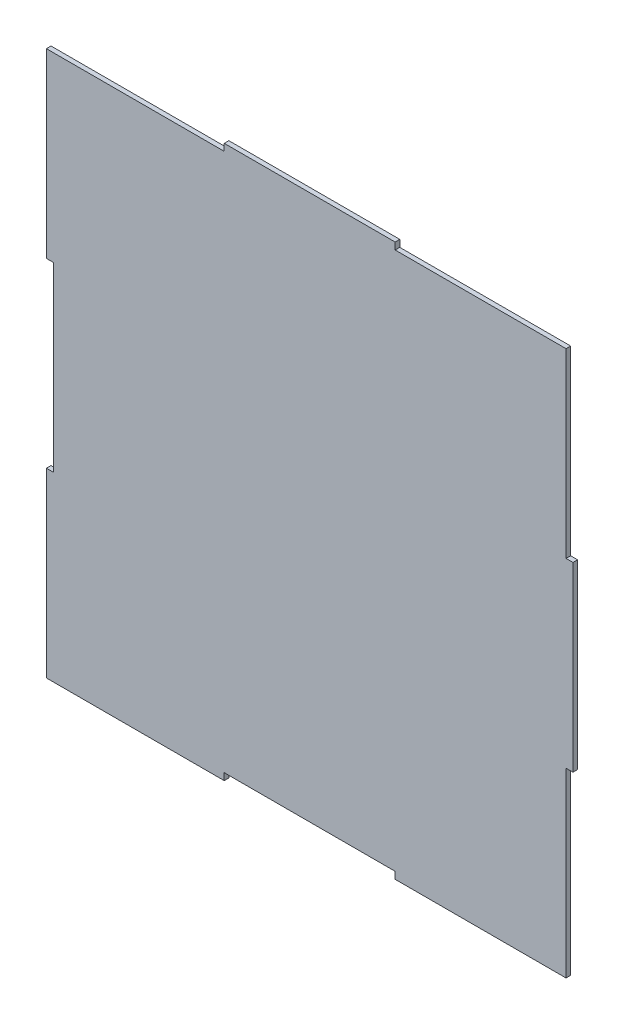
from build123d import *

# Parameters (mm, degrees)
BOSS_EXTRUDE1_DEPTH = 2


with BuildPart() as part:
    # Sketch1 → Boss-Extrude1 (new body)
    with BuildSketch(Plane.XY):
        Polygon((37, -118), (111, -118), (111, -39.333333333), (114, -39.333333333), (114, 39.333333333), (111, 39.333333333), (111, 118), (37, 118), (37, 121), (-37, 121), (-37, 118), (-111, 118), (-114, 118), (-114, 39.333333333), (-111, 39.333333333), (-111, -39.333333333), (-114, -39.333333333), (-114, -118), (-111, -118), (-37, -118), (-37, -115), (37, -115), align=None)
    extrude(amount=BOSS_EXTRUDE1_DEPTH)


solid = part.part
